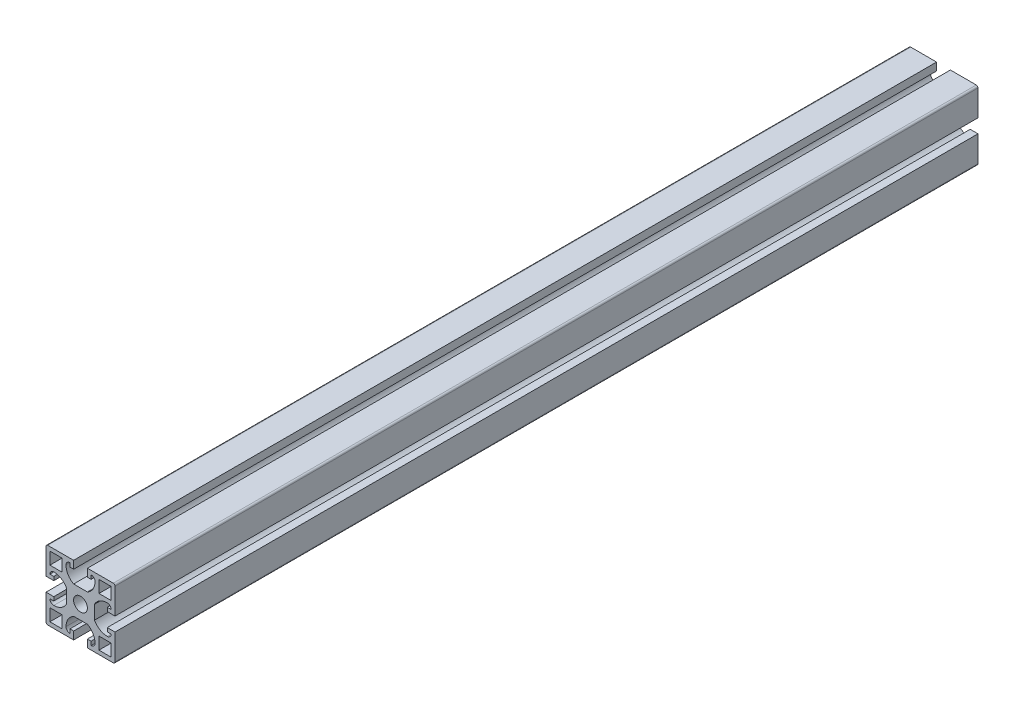
from build123d import *

# Parameters (mm, degrees)
SZKIC1_R                    = 4
SZKIC1_W                    = 7.071067812
SZKIC1_H                    = 7.071067812
DODANIE_WYCI_GNI_CIE1_DEPTH = 500


with BuildPart() as part:
    # Szkic1 → Dodanie-wyciągnięcie1 (new body)
    with BuildSketch(Plane.XY):
        with BuildLine():
            Line((4, 20), (4, 15.5))
            Line((4, 15.5), (6.166140933, 15.5))
            Line((6.166140933, 15.5), (6.166140933, 17.75))
            ThreePointArc((6.166140933, 17.75), (7.757131191, 17.090990258), (8.416140933, 15.5))
            ThreePointArc((8.416140933, 15.5), (7.228277524, 11.189149476), (4, 8.095175343))
            Line((4, 8.095175343), (-4, 8.095175343))
            ThreePointArc((-4, 8.095175343), (-7.228277524, 11.189149476), (-8.416140933, 15.5))
            ThreePointArc((-8.416140933, 15.5), (-7.757131191, 17.090990258), (-6.166140933, 17.75))
            Line((-6.166140933, 17.75), (-6.166140933, 15.5))
            Line((-6.166140933, 15.5), (-4, 15.5))
            Line((-4, 15.5), (-4, 20))
            Line((-4, 20), (-19, 20))
            ThreePointArc((-19, 20), (-19.707106781, 19.707106781), (-20, 19))
            Line((-20, 19), (-20, 4))
            Line((-20, 4), (-15.5, 4))
            Line((-15.5, 4), (-15.5, 6.166140933))
            Line((-15.5, 6.166140933), (-17.75, 6.166140933))
            ThreePointArc((-17.75, 6.166140933), (-17.090990258, 7.757131191), (-15.5, 8.416140933))
            ThreePointArc((-15.5, 8.416140933), (-11.189149476, 7.228277524), (-8.095175343, 4))
            Line((-8.095175343, 4), (-8.095175343, -4))
            ThreePointArc((-8.095175343, -4), (-11.189149476, -7.228277524), (-15.5, -8.416140933))
            ThreePointArc((-15.5, -8.416140933), (-17.090990258, -7.757131191), (-17.75, -6.166140933))
            Line((-17.75, -6.166140933), (-15.5, -6.166140933))
            Line((-15.5, -6.166140933), (-15.5, -4))
            Line((-15.5, -4), (-20, -4))
            Line((-20, -4), (-20, -19))
            ThreePointArc((-20, -19), (-19.707106781, -19.707106781), (-19, -20))
            Line((-19, -20), (-4, -20))
            Line((-4, -20), (-4, -15.5))
            Line((-4, -15.5), (-6.166140933, -15.5))
            Line((-6.166140933, -15.5), (-6.166140933, -17.75))
            ThreePointArc((-6.166140933, -17.75), (-7.757131191, -17.090990258), (-8.416140933, -15.5))
            ThreePointArc((-8.416140933, -15.5), (-7.228277524, -11.189149476), (-4, -8.095175343))
            Line((-4, -8.095175343), (4, -8.095175343))
            ThreePointArc((4, -8.095175343), (7.228277524, -11.189149476), (8.416140933, -15.5))
            ThreePointArc((8.416140933, -15.5), (7.757131191, -17.090990258), (6.166140933, -17.75))
            Line((6.166140933, -17.75), (6.166140933, -15.5))
            Line((6.166140933, -15.5), (4, -15.5))
            Line((4, -15.5), (4, -20))
            Line((4, -20), (19, -20))
            ThreePointArc((19, -20), (19.707106781, -19.707106781), (20, -19))
            Line((20, -19), (20, -4))
            Line((20, -4), (15.5, -4))
            Line((15.5, -4), (15.5, -6.166140933))
            Line((15.5, -6.166140933), (17.75, -6.166140933))
            ThreePointArc((17.75, -6.166140933), (17.090990258, -7.757131191), (15.5, -8.416140933))
            ThreePointArc((15.5, -8.416140933), (11.189149476, -7.228277524), (8.095175343, -4))
            Line((8.095175343, -4), (8.095175343, 4))
            ThreePointArc((8.095175343, 4), (11.189149476, 7.228277524), (15.5, 8.416140933))
            ThreePointArc((15.5, 8.416140933), (17.090990258, 7.757131191), (17.75, 6.166140933))
            Line((17.75, 6.166140933), (15.5, 6.166140933))
            Line((15.5, 6.166140933), (15.5, 4))
            Line((15.5, 4), (20, 4))
            Line((20, 4), (20, 19))
            ThreePointArc((20, 19), (19.707106781, 19.707106781), (19, 20))
            Line((19, 20), (4, 20))
        make_face()
        Circle(SZKIC1_R, mode=Mode.SUBTRACT)
        with Locations((-14.214466094, 14.214466094)):
            Rectangle(SZKIC1_W, SZKIC1_H, mode=Mode.SUBTRACT)
        with Locations((14.214466094, 14.214466094)):
            Rectangle(SZKIC1_W, SZKIC1_H, mode=Mode.SUBTRACT)
        with Locations((14.214466094, -14.214466094)):
            Rectangle(SZKIC1_W, SZKIC1_H, mode=Mode.SUBTRACT)
        with Locations((-14.214466094, -14.214466094)):
            Rectangle(SZKIC1_W, SZKIC1_H, mode=Mode.SUBTRACT)
    extrude(amount=DODANIE_WYCI_GNI_CIE1_DEPTH)


solid = part.part
